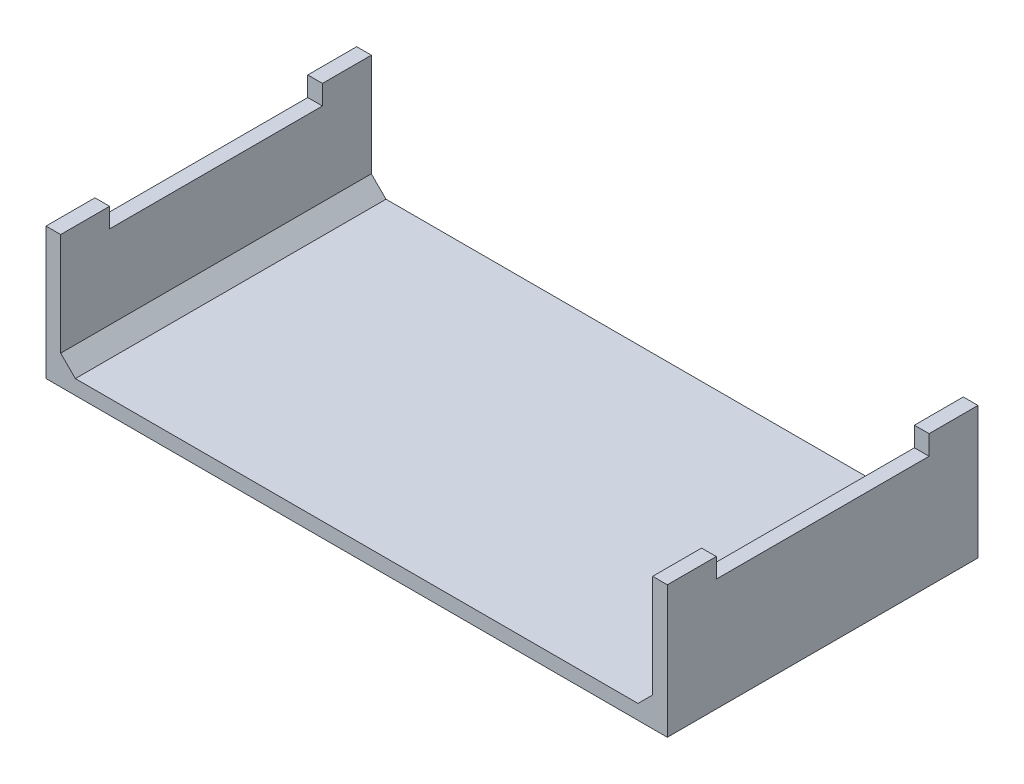
from build123d import *

# Parameters (mm, degrees)
SKETCH1_W           = 127
SKETCH1_H           = 63.5
BOSS_EXTRUDE1_DEPTH = 3
SKETCH2_W           = 3
SKETCH2_H           = 63.5
BOSS_EXTRUDE2_DEPTH = 20
CHAMFER1_SIZE       = 3
SKETCH3_W           = 3
SKETCH3_H           = 10
BOSS_EXTRUDE3_DEPTH = 4


with BuildPart() as part:
    # Sketch1 → Boss-Extrude1 (new body)
    with BuildSketch(Plane(origin=(0, 0, 0), x_dir=(1, 0, 0), z_dir=(0, 1, 0))):
        Rectangle(SKETCH1_W, SKETCH1_H)
    extrude(amount=BOSS_EXTRUDE1_DEPTH)

    # Sketch2 → Boss-Extrude2 (add)
    with BuildSketch(Plane(origin=(0, 3, 0), x_dir=(1, 0, 0), z_dir=(0, 1, 0))):
        with Locations((-62, 0)):
            Rectangle(SKETCH2_W, SKETCH2_H)
        with Locations((62, 0)):
            Rectangle(SKETCH2_W, SKETCH2_H)
    extrude(amount=BOSS_EXTRUDE2_DEPTH)

    # Chamfer1
    chamfer1_edges = [part.edges().sort_by_distance(p)[0] for p in [
        (-60.5, 3, 0),
        (60.5, 3, 0),
    ]]
    chamfer(chamfer1_edges, length=CHAMFER1_SIZE)

    # Sketch3 → Boss-Extrude3 (add)
    with BuildSketch(Plane(origin=(0, 23, 0), x_dir=(1, 0, 0), z_dir=(0, 1, 0))):
        with Locations((-62, 26.75)):
            Rectangle(SKETCH3_W, SKETCH3_H)
        with Locations((-62, -26.75)):
            Rectangle(SKETCH3_W, SKETCH3_H)
        with Locations((62, 26.75)):
            Rectangle(SKETCH3_W, SKETCH3_H)
        with Locations((62, -26.75)):
            Rectangle(SKETCH3_W, SKETCH3_H)
    extrude(amount=BOSS_EXTRUDE3_DEPTH)


solid = part.part
